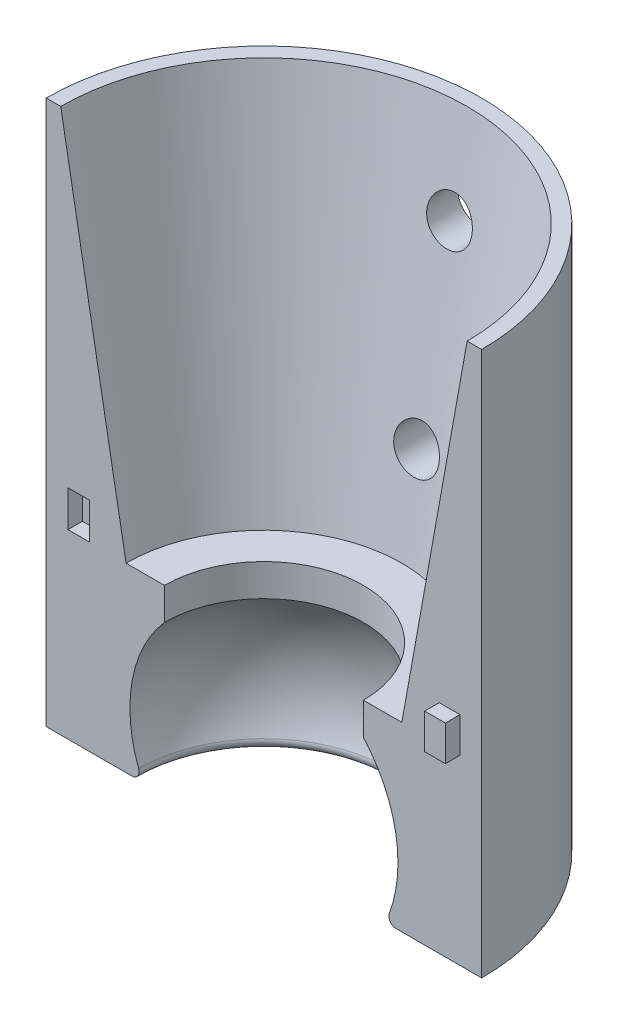
from build123d import *

# Parameters (mm, degrees)
REVOLVE8_ANGLE      = 180
SKETCH5_W           = 2.85
SKETCH5_H           = 4.85
BOSS_EXTRUDE1_DEPTH = 2
SKETCH6_W           = 3
SKETCH6_H           = 5
CUT_EXTRUDE1_DEPTH  = 2
FILLET1_R           = 1
SKETCH7_R           = 3.1
CUT_EXTRUDE2_DEPTH  = 40


with BuildPart() as part:
    # Sketch3 → Revolve8 (revolve)
    with BuildSketch(Plane.XY):
        with BuildLine():
            Line((-28.127877823, 11.200453936), (-37.127877823, 61.200453936))
            Line((-37.127877823, 61.200453936), (-39.127877823, 61.200453936))
            Line((-39.127877823, 61.200453936), (-39.127877823, -13.799546064))
            Line((-39.127877823, -13.799546064), (-25.829212511, -13.799546064))
            ThreePointArc((-25.829212511, -13.799546064), (-27.397927857, -3.066483557), (-22.838440036, 6.77580121))
            Line((-22.838440036, 6.77580121), (-22.838440036, 11.200453936))
            Line((-22.838440036, 11.200453936), (-28.127877823, 11.200453936))
        make_face()
    revolve(axis=Axis((-9.127877823, 95.858464184, 0), (0, -1, 0)), revolution_arc=REVOLVE8_ANGLE)

    # Sketch5 → Boss-Extrude1 (add)
    with BuildSketch(Plane.XY):
        with Locations((16.447122177, 13.700453936)):
            Rectangle(SKETCH5_W, SKETCH5_H)
    extrude(amount=BOSS_EXTRUDE1_DEPTH)

    # Sketch6 → Cut-Extrude1 (cut)
    with BuildSketch(Plane.XY):
        with Locations((-34.627877823, 13.700453936)):
            Rectangle(SKETCH6_W, SKETCH6_H)
    extrude(amount=-CUT_EXTRUDE1_DEPTH, mode=Mode.SUBTRACT)

    # Fillet1
    fillet1_edges = [part.edges().sort_by_distance(p)[0] for p in [
        (-9.127877823, -13.799546064, -16.701334688),
    ]]
    fillet(fillet1_edges, radius=FILLET1_R)

    # Sketch7 → Cut-Extrude2 (cut)
    with BuildSketch(Plane.XY):
        with Locations((-9.127877823, 23.700453936)):
            Circle(SKETCH7_R)
        with Locations((-9.127877823, 48.700453936)):
            Circle(SKETCH7_R)
    extrude(amount=-CUT_EXTRUDE2_DEPTH, mode=Mode.SUBTRACT)


solid = part.part
